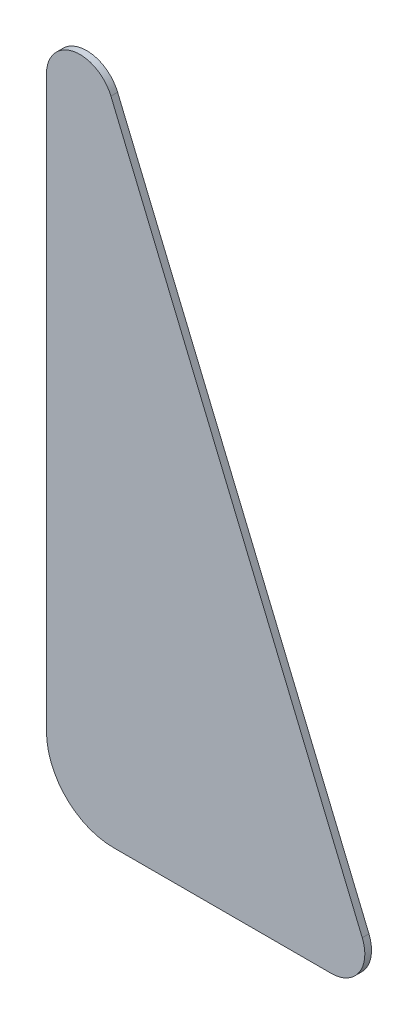
from build123d import *

# Parameters (mm, degrees)
BOSS_EXTRUDE1_DEPTH = 10


with BuildPart() as part:
    # Sketch1 → Boss-Extrude1 (new body)
    with BuildSketch(Plane.XY):
        with BuildLine():
            Line((0, 100), (0, 950))
            ThreePointArc((0, 950), (40.194193243, 999.029033785), (96.153846154, 969.230769231))
            Line((96.153846154, 969.230769231), (471.153846154, 69.230769231))
            ThreePointArc((471.153846154, 69.230769231), (466.602514717, 22.264990189), (425, 0))
            Line((425, 0), (100, 0))
            ThreePointArc((100, 0), (29.289321881, 29.289321881), (0, 100))
        make_face()
    extrude(amount=BOSS_EXTRUDE1_DEPTH)


solid = part.part
